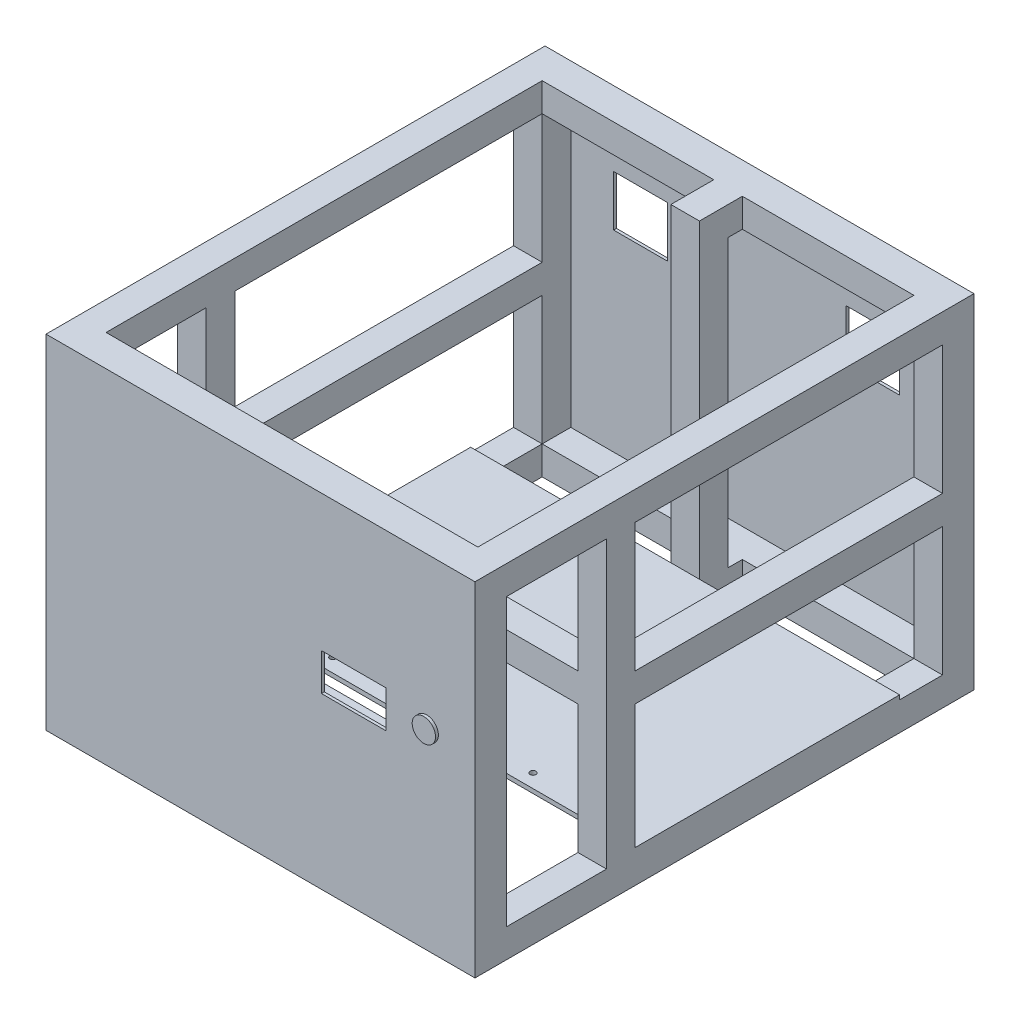
from build123d import *

# Parameters (mm, degrees)
SKETCH_1_W          = 300
SKETCH_1_H          = 345
EXTRUDE_1_DEPTH     = 240
SKETCH_2_W          = 260
SKETCH_2_H          = 305
CUT_EXTRUDE_1_DEPTH = 240
SKETCH_3_W          = 260
SKETCH_3_H          = 200
CUT_EXTRUDE_2_DEPTH = 345
SKETCH_4_W          = 305
SKETCH_4_H          = 200
CUT_EXTRUDE_3_DEPTH = 345
SKETCH_5_W          = 20
SKETCH_5_H          = 240
EXTRUDE_2_DEPTH     = 20
SKETCH_6_W          = 20
SKETCH_6_H          = 240
EXTRUDE_3_DEPTH     = 20
SKETCH_10_W         = 20
SKETCH_10_H         = 240
EXTRUDE_7_DEPTH     = 50
SKETCH_11_W         = 20
SKETCH_11_H         = 200
CUT_EXTRUDE_4_DEPTH = 50
SKETCH_12_W         = 20
SKETCH_12_H         = 20
EXTRUDE_8_DEPTH     = 240
SKETCH_13_W         = 20
SKETCH_13_H         = 20
EXTRUDE_9_DEPTH     = 300
SKETCH_14_W         = 300
SKETCH_14_H         = 185
EXTRUDE_10_DEPTH    = 3
SKETCH_15_R         = 2.05
CUT_EXTRUDE_5_DEPTH = 3
SKETCH_16_W         = 215
SKETCH_16_H         = 20
EXTRUDE_11_DEPTH    = 20
SKETCH_17_W         = 215
SKETCH_17_H         = 20
EXTRUDE_12_DEPTH    = 20
SKETCH_18_W         = 300
SKETCH_18_H         = 240
EXTRUDE_13_DEPTH    = 2
SKETCH_20_W         = 300
SKETCH_20_H         = 240
EXTRUDE_14_DEPTH    = 2
SKETCH_21_R         = 8.165036004
EXTRUDE_15_DEPTH    = 2
SKETCH_22_W         = 300
SKETCH_22_H         = 20
EXTRUDE_16_DEPTH    = 22
SKETCH_24_W         = 45
SKETCH_24_H         = 26
CUT_EXTRUDE_6_DEPTH = 2
SKETCH_25_W         = 37.5
SKETCH_25_H         = 35.5
CUT_EXTRUDE_7_DEPTH = 2
SKETCH_26_W         = 37.5
SKETCH_26_H         = 35.5
CUT_EXTRUDE_8_DEPTH = 2
SKETCH_27_R         = 4
EXTRUDE_17_DEPTH    = 10
SKETCH_28_R         = 4
EXTRUDE_18_DEPTH    = 10


with BuildPart() as part:
    # 草图1 → 凸台-拉伸1 (new body)
    with BuildSketch(Plane(origin=(0, 0, 0), x_dir=(1, 0, 0), z_dir=(0, 1, 0))):
        Rectangle(SKETCH_1_W, SKETCH_1_H)
    extrude(amount=EXTRUDE_1_DEPTH)

    # 草图2 → 切除-拉伸1 (cut)
    with BuildSketch(Plane(origin=(0, 240, 0), x_dir=(1, 0, 0), z_dir=(0, 1, 0))):
        Rectangle(SKETCH_2_W, SKETCH_2_H)
    extrude(amount=-CUT_EXTRUDE_1_DEPTH, mode=Mode.SUBTRACT)

    # 草图3 → 切除-拉伸2 (cut)
    with BuildSketch(Plane.XY.offset(172.5)):
        with Locations((0, 120)):
            Rectangle(SKETCH_3_W, SKETCH_3_H)
    extrude(amount=-CUT_EXTRUDE_2_DEPTH, mode=Mode.SUBTRACT)

    # 草图4 → 切除-拉伸3 (cut)
    with BuildSketch(Plane.ZY.offset(150)):
        with Locations((0, 120)):
            Rectangle(SKETCH_4_W, SKETCH_4_H)
    extrude(amount=-CUT_EXTRUDE_3_DEPTH, mode=Mode.SUBTRACT)

    # 草图5 → 凸台-拉伸2 (add)
    with BuildSketch(Plane(origin=(150, 0, 0), x_dir=(0, 0, -1), z_dir=(1, 0, 0))):
        with Locations((-72.5, 120)):
            Rectangle(SKETCH_5_W, SKETCH_5_H)
    extrude(amount=-EXTRUDE_2_DEPTH)

    # 草图6 → 凸台-拉伸3 (add)
    with BuildSketch(Plane.ZY.offset(150)):
        with Locations((72.5, 120)):
            Rectangle(SKETCH_6_W, SKETCH_6_H)
    extrude(amount=-EXTRUDE_3_DEPTH)

    # 草图10 → 凸台-拉伸7 (add)
    with BuildSketch(Plane(origin=(0, 0, -172.5), x_dir=(-1, 0, 0), z_dir=(0, 0, -1))):
        with Locations((0, 120)):
            Rectangle(SKETCH_10_W, SKETCH_10_H)
    extrude(amount=-EXTRUDE_7_DEPTH)

    # 草图11 → 切除-拉伸4 (cut)
    with BuildSketch(Plane(origin=(0, 0, -172.5), x_dir=(-1, 0, 0), z_dir=(0, 0, -1))):
        with Locations((0, 120)):
            Rectangle(SKETCH_11_W, SKETCH_11_H)
    extrude(amount=-CUT_EXTRUDE_4_DEPTH, mode=Mode.SUBTRACT)

    # 草图12 → 凸台-拉伸8 (add)
    with BuildSketch(Plane(origin=(0, 240, 0), x_dir=(1, 0, 0), z_dir=(0, 1, 0))):
        with Locations((0, 132.5)):
            Rectangle(SKETCH_12_W, SKETCH_12_H)
    extrude(amount=-EXTRUDE_8_DEPTH)

    # 草图13 → 凸台-拉伸9 (add)
    with BuildSketch(Plane(origin=(150, 0, 0), x_dir=(0, 0, -1), z_dir=(1, 0, 0))):
        with Locations((-72.5, 120)):
            Rectangle(SKETCH_13_W, SKETCH_13_H)
    extrude(amount=-EXTRUDE_9_DEPTH)

    # 草图14 → 凸台-拉伸10 (add)
    with BuildSketch(Plane(origin=(0, 20, 0), x_dir=(1, 0, 0), z_dir=(0, 1, 0))):
        with Locations((0, 30)):
            Rectangle(SKETCH_14_W, SKETCH_14_H)
    extrude(amount=EXTRUDE_10_DEPTH)

    # 草图15 → 切除-拉伸5 (cut)
    with BuildSketch(Plane(origin=(0, 23, 0), x_dir=(1, 0, 0), z_dir=(0, 1, 0))):
        with Locations(Location((-70.947060375, -52.987042074, 0), (0, 0, 270))):
            Circle(SKETCH_15_R)
        with Locations(Location((-0.947060375, -52.987042074, 0), (0, 0, 270))):
            Circle(SKETCH_15_R)
        with Locations(Location((69.052939625, -52.987042074, 0), (0, 0, 270))):
            Circle(SKETCH_15_R)
    extrude(amount=-CUT_EXTRUDE_5_DEPTH, mode=Mode.SUBTRACT)

    # 草图16 → 凸台-拉伸11 (add)
    with BuildSketch(Plane(origin=(150, 0, 0), x_dir=(0, 0, -1), z_dir=(1, 0, 0))):
        with Locations((45, 120)):
            Rectangle(SKETCH_16_W, SKETCH_16_H)
    extrude(amount=-EXTRUDE_11_DEPTH)

    # 草图17 → 凸台-拉伸12 (add)
    with BuildSketch(Plane.ZY.offset(150)):
        with Locations((-45, 120)):
            Rectangle(SKETCH_17_W, SKETCH_17_H)
    extrude(amount=-EXTRUDE_12_DEPTH)

    # 草图18 → 凸台-拉伸13 (add)
    with BuildSketch(Plane.XY.offset(172.5)):
        with Locations((0, 120)):
            Rectangle(SKETCH_18_W, SKETCH_18_H)
    extrude(amount=EXTRUDE_13_DEPTH)

    # 草图20 → 凸台-拉伸14 (add)
    with BuildSketch(Plane(origin=(0, 0, -172.5), x_dir=(-1, 0, 0), z_dir=(0, 0, -1))):
        with Locations((0, 120)):
            Rectangle(SKETCH_20_W, SKETCH_20_H)
    extrude(amount=EXTRUDE_14_DEPTH)

    # 草图21 → 凸台-拉伸15 (add)
    with BuildSketch(Plane.XY.offset(174.5)):
        with Locations((116.249294112, 134.333303452)):
            Circle(SKETCH_21_R)
    extrude(amount=EXTRUDE_15_DEPTH)

    # 草图22 → 凸台-拉伸16 (add)
    with BuildSketch(Plane.XY.offset(174.5)):
        with Locations((0, 178.667130527)):
            Rectangle(SKETCH_22_W, SKETCH_22_H)
        with Locations((0, 93.667130527)):
            Rectangle(SKETCH_22_W, SKETCH_22_H)
    extrude(amount=-EXTRUDE_16_DEPTH)

    # 草图24 → 切除-拉伸6 (cut)
    with BuildSketch(Plane.XY.offset(174.5)):
        with Locations((65.114949377, 131.614411481)):
            Rectangle(SKETCH_24_W, SKETCH_24_H)
    extrude(amount=-CUT_EXTRUDE_6_DEPTH, mode=Mode.SUBTRACT)

    # 草图25 → 切除-拉伸7 (cut)
    with BuildSketch(Plane(origin=(0, 0, -174.5), x_dir=(-1, 0, 0), z_dir=(0, 0, -1))):
        with Locations((81.25, 172.25)):
            Rectangle(SKETCH_25_W, SKETCH_25_H)
    extrude(amount=-CUT_EXTRUDE_7_DEPTH, mode=Mode.SUBTRACT)

    # 草图26 → 切除-拉伸8 (cut)
    with BuildSketch(Plane(origin=(0, 0, -174.5), x_dir=(-1, 0, 0), z_dir=(0, 0, -1))):
        with Locations((-81.25, 172.25)):
            Rectangle(SKETCH_26_W, SKETCH_26_H)
    extrude(amount=-CUT_EXTRUDE_8_DEPTH, mode=Mode.SUBTRACT)

    # 草图27 → 凸台-拉伸17 (add)
    with BuildSketch(Plane(origin=(0, 0, -174.5), x_dir=(-1, 0, 0), z_dir=(0, 0, -1))):
        with Locations((-104.657434269, 57.050217573)):
            Circle(SKETCH_27_R)
        with Locations((-64.657434269, 57.050217573)):
            Circle(SKETCH_27_R)
    extrude(amount=EXTRUDE_17_DEPTH)

    # 草图28 → 凸台-拉伸18 (add)
    with BuildSketch(Plane(origin=(0, 0, -174.5), x_dir=(-1, 0, 0), z_dir=(0, 0, -1))):
        with Locations((54.161932501, 57.839316769)):
            Circle(SKETCH_28_R)
        with Locations((94.161932501, 57.839316769)):
            Circle(SKETCH_28_R)
    extrude(amount=EXTRUDE_18_DEPTH)


solid = part.part
